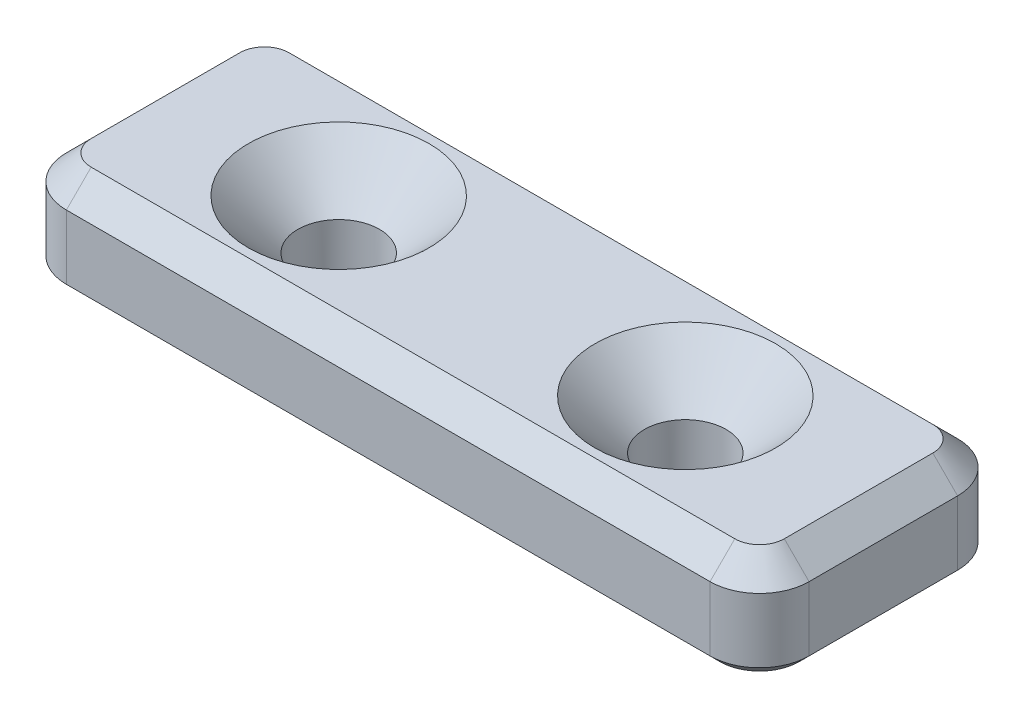
from build123d import *

# Parameters (mm, degrees)
SKETCH_1_W          = 30
SKETCH_1_H          = 10
EXTRUDE_1_DEPTH     = 4
SKETCH_2_R          = 1.65
CUT_EXTRUDE_1_DEPTH = 32.874754901
CHAMFER_1_SIZE      = 2
FILLET_1_R          = 2
CHAMFER_2_SIZE      = 0.4
CHAMFER_3_SIZE      = 1


with BuildPart() as part:
    # 草图1 → 凸台-拉伸1 (new body)
    with BuildSketch(Plane(origin=(0, 0, 0), x_dir=(1, 0, 0), z_dir=(0, 1, 0))):
        with Locations((15, 5)):
            Rectangle(SKETCH_1_W, SKETCH_1_H)
    extrude(amount=EXTRUDE_1_DEPTH)

    # 草图2 → 切除-拉伸1 (cut, through all)
    with BuildSketch(Plane(origin=(0, 4, 0), x_dir=(1, 0, 0), z_dir=(0, 1, 0))):
        with Locations(Location((8, 5, 0), (0, 0, 270))):
            Circle(SKETCH_2_R)
        with Locations(Location((22, 5, 0), (0, 0, 270))):
            Circle(SKETCH_2_R)
    extrude(amount=-CUT_EXTRUDE_1_DEPTH, mode=Mode.SUBTRACT)

    # 倒角1
    chamfer_1_edges = [part.edges().sort_by_distance(p)[0] for p in [
        (8, 4, -6.65),
        (22, 4, -6.65),
    ]]
    chamfer(chamfer_1_edges, length=CHAMFER_1_SIZE)

    # 圆角1
    fillet_1_edges = [part.edges().sort_by_distance(p)[0] for p in [
        (0, 2, -10),
        (30, 2, -10),
        (30, 2, 0),
        (0, 2, 0),
    ]]
    fillet(fillet_1_edges, radius=FILLET_1_R)

    # 倒角2
    chamfer_2_edges = [part.edges().sort_by_distance(p)[0] for p in [
        (15, 0, -10),
        (0, 0, -5),
        (30, 0, -5),
        (15, 0, 0),
        (0.585786438, 0, -9.414213562),
        (0.585786438, 0, -0.585786438),
        (29.414213562, 0, -0.585786438),
        (29.414213562, 0, -9.414213562),
    ]]
    chamfer(chamfer_2_edges, length=CHAMFER_2_SIZE)

    # 倒角3
    chamfer_3_edges = [part.edges().sort_by_distance(p)[0] for p in [
        (15, 4, -10),
        (30, 4, -5),
        (0, 4, -5),
        (15, 4, 0),
        (0.585786438, 4, -9.414213562),
        (0.585786438, 4, -0.585786438),
        (29.414213562, 4, -0.585786438),
        (29.414213562, 4, -9.414213562),
    ]]
    chamfer(chamfer_3_edges, length=CHAMFER_3_SIZE)


solid = part.part
